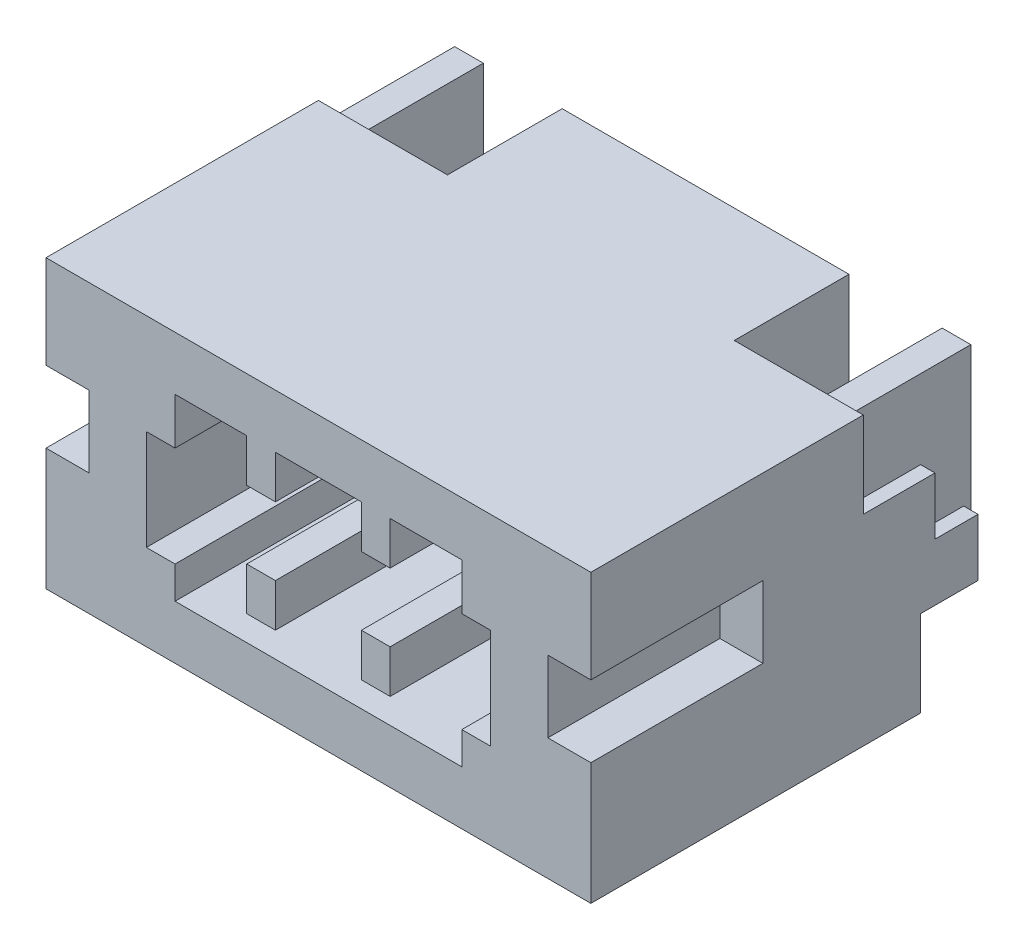
from build123d import *

# Parameters (mm, degrees)
SKIZZE1_W                                   = 3.8
SKIZZE1_H                                   = 2
AUFSATZ_LINEAR_AUSTRAGEN1_DEPTH             = 2.7
SCHNITT_LINEAR_AUSTRAGEN1_DEPTH             = 4.449637662
SCHNITT_LINEAR_AUSTRAGEN1_DEPTH_BACK        = 4.449637662
SKIZZE2_W                                   = 0.4
SKIZZE2_H                                   = 0.6
SCHNITT_LINEAR_START                        = -1
SCHNITT_LINEAR_AUSTRAGEN4_DEPTH             = 3.449637662
AUFSATZ_LINEAR_START                        = -0.4
AUFSATZ_LINEAR_AUSTRAGEN2_DEPTH             = 0.1
AUFSATZ_LINEAR_AUSTRAGEN3_REACH             = 5.513
SKIZZE5_W                                   = 0.2
SKIZZE5_H                                   = 1
AUFSATZ_LINEAR_AUSTRAGEN3_DIRECTION_2_DEPTH = 0.05
SCHNITT_LINEAR_START_2                      = 1
SKIZZE6_W                                   = 0.2
SKIZZE6_H                                   = 0.3
SCHNITT_LINEAR_AUSTRAGEN5_DEPTH             = 3.512833614
SKIZZE7_W                                   = 0.2
SKIZZE7_H                                   = 0.7
SCHNITT_LINEAR_AUSTRAGEN6_DEPTH             = 3.512833614
SCHNITT_LINEAR_START_3                      = 1.5
SKIZZE8_W                                   = 0.3
SKIZZE8_H                                   = 0.5
SCHNITT_LINEAR_AUSTRAGEN7_DEPTH             = 3.012833614


with BuildPart() as part:
    # Skizze1 → Aufsatz-Linear austragen1 (new body)
    with BuildSketch(Plane.XY):
        Rectangle(SKIZZE1_W, SKIZZE1_H)
    extrude(amount=AUFSATZ_LINEAR_AUSTRAGEN1_DEPTH)

    # Skizze2 → Schnitt-Linear austragen1 (cut, two sides: drawn at the far end of the back side and taken through both)
    with BuildSketch(Plane(origin=(0, 0, 0), x_dir=(0, 0, -1), z_dir=(1, 0, 0)).offset(-SCHNITT_LINEAR_AUSTRAGEN1_DEPTH_BACK)):
        with Locations((-0.2, -0.7)):
            Rectangle(SKIZZE2_W, SKIZZE2_H)
    extrude(amount=SCHNITT_LINEAR_AUSTRAGEN1_DEPTH + SCHNITT_LINEAR_AUSTRAGEN1_DEPTH_BACK, mode=Mode.SUBTRACT)

    # Skizze3 → Schnitt-Linear austragen4 (cut, through all)
    with BuildSketch(Plane(origin=(0, 0, 0), x_dir=(0, 0, -1), z_dir=(1, 0, 0)).offset(SCHNITT_LINEAR_START)):
        Polygon((-0.8, 1), (-0.8, 0.4), (-0.3, 0.4), (-0.3, 0), (0, 0), (0, 1), align=None)
    schnitt_linear_austragen4 = extrude(amount=-SCHNITT_LINEAR_AUSTRAGEN4_DEPTH, mode=Mode.SUBTRACT)

    # Skizze4 → Aufsatz-Linear austragen2 (add, symmetric)
    with BuildSketch(Plane(origin=(0, 0, 0), x_dir=(0, 0, -1), z_dir=(1, 0, 0)).offset(AUFSATZ_LINEAR_START)):
        Polygon((-0.15, -0.4), (0.05, -0.6), (0.05, -1.2), (-0.1, -1.2), (-0.1, -0.732842712), (-0.432842712, -0.4), align=None)
    aufsatz_linear_austragen2 = extrude(amount=AUFSATZ_LINEAR_AUSTRAGEN2_DEPTH, both=True)

    # Skizze5 → Aufsatz-Linear austragen3 (add, up to next)
    with BuildSketch(Plane.XY, mode=Mode.PRIVATE) as aufsatz_linear_austragen3_sk1:
        with Locations((-1.7, 0.45)):
            Rectangle(SKIZZE5_W, SKIZZE5_H)
    aufsatz_linear_austragen3_tool1 = extrude(aufsatz_linear_austragen3_sk1.sketch, amount=AUFSATZ_LINEAR_AUSTRAGEN3_REACH, mode=Mode.PRIVATE) - part.part
    aufsatz_linear_austragen3 = aufsatz_linear_austragen3_tool1.solids().sort_by_distance((-1.7, 0.45, 0))[0]
    add(aufsatz_linear_austragen3)

    # Skizze5 → Aufsatz-Linear austragen3 direction 2 (add)
    with BuildSketch(Plane.XY):
        with Locations((-1.7, 0.45)):
            Rectangle(SKIZZE5_W, SKIZZE5_H)
    aufsatz_linear_austragen3_direction_2 = extrude(amount=-AUFSATZ_LINEAR_AUSTRAGEN3_DIRECTION_2_DEPTH)

    # Skizze6 → Schnitt-Linear austragen5 (cut, through all)
    with BuildSketch(Plane.XY.offset(SCHNITT_LINEAR_START_2)):
        Polygon((-1, 0.625), (-1, -0.625), (1, -0.625), (1, 0.625), (0.5, 0.625), (0.5, 0.325), (0.3, 0.325), (0.3, 0.625), (-0.3, 0.625), (-0.3, 0.325), (-0.5, 0.325), (-0.5, 0.625), align=None)
        with Locations((-0.4, -0.3)):
            Rectangle(SKIZZE6_W, SKIZZE6_H, mode=Mode.SUBTRACT)
        with Locations((0.4, -0.3)):
            Rectangle(SKIZZE6_W, SKIZZE6_H, mode=Mode.SUBTRACT)
    extrude(amount=SCHNITT_LINEAR_AUSTRAGEN5_DEPTH, mode=Mode.SUBTRACT)

    # Skizze7 → Schnitt-Linear austragen6 (cut, through all)
    with BuildSketch(Plane.XY.offset(SCHNITT_LINEAR_START_2)):
        with Locations((-1.1, -0.05)):
            Rectangle(SKIZZE7_W, SKIZZE7_H)
        with Locations((1.1, -0.05)):
            Rectangle(SKIZZE7_W, SKIZZE7_H)
    extrude(amount=SCHNITT_LINEAR_AUSTRAGEN6_DEPTH, mode=Mode.SUBTRACT)

    # Skizze8 → Schnitt-Linear austragen7 (cut, through all)
    with BuildSketch(Plane.XY.offset(SCHNITT_LINEAR_START_3)):
        with Locations((-1.75, 0.1)):
            Rectangle(SKIZZE8_W, SKIZZE8_H)
        with Locations((1.75, 0.1)):
            Rectangle(SKIZZE8_W, SKIZZE8_H)
    extrude(amount=SCHNITT_LINEAR_AUSTRAGEN7_DEPTH, mode=Mode.SUBTRACT)

    # Spiegeln1: Schnitt-Linear austragen4, Aufsatz-Linear austragen2, Aufsatz-Linear austragen3, Aufsatz-Linear austragen3 direction 2 across plane
    add(schnitt_linear_austragen4.mirror(Plane(origin=(0, 0, 0), x_dir=(0, 0, 1), z_dir=(1, 0, 0))), mode=Mode.SUBTRACT)
    add(aufsatz_linear_austragen2.mirror(Plane(origin=(0, 0, 0), x_dir=(0, 0, 1), z_dir=(1, 0, 0))))
    add(aufsatz_linear_austragen3.mirror(Plane(origin=(0, 0, 0), x_dir=(0, 0, 1), z_dir=(1, 0, 0))))
    add(aufsatz_linear_austragen3_direction_2.mirror(Plane(origin=(0, 0, 0), x_dir=(0, 0, 1), z_dir=(1, 0, 0))))


solid = part.part
